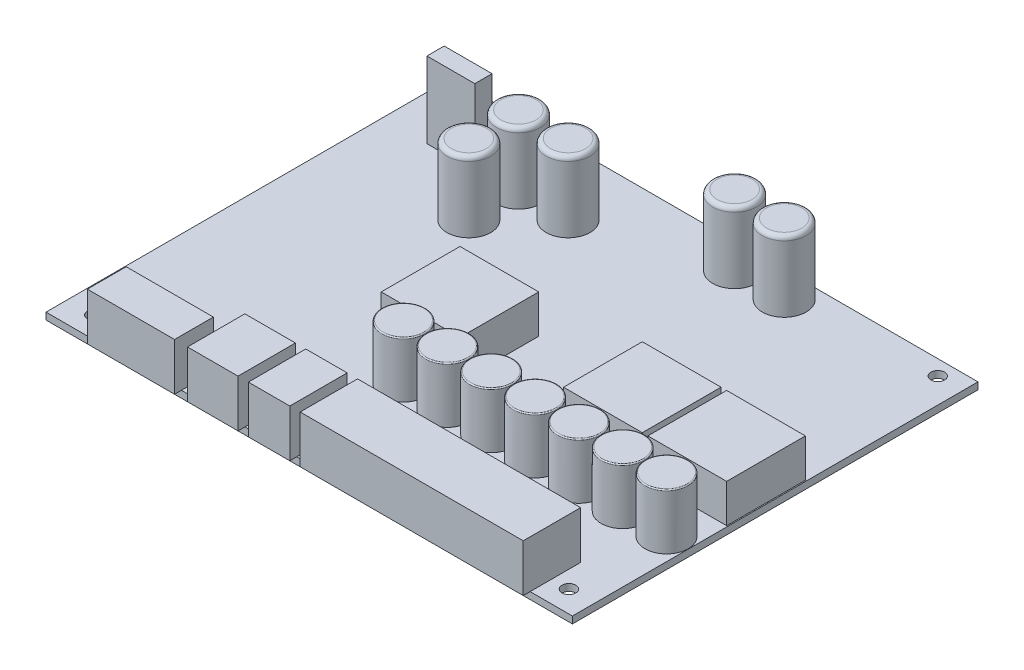
from build123d import *

# Parameters (mm, degrees)
SKETCH1_W              = 122
SKETCH1_H              = 94
BOSS_EXTRUDE1_DEPTH    = 1.6
SKETCH2_R              = 1.585
CUT_EXTRUDE1_DEPTH     = 78.023113414
SKETCH3_R              = 5.085
BOSS_EXTRUDE2_DEPTH    = 16.35
FILLET1_R              = 1.016
SKETCH4_R              = 5
BOSS_EXTRUDE3_DEPTH    = 12.9
FILLET2_R              = 0.254
LPATTERN1_COUNT        = 7
LPATTERN1_PITCH        = 10.16
FILLET2_OF_LPATTERN1_R = 0.254
SKETCH5_W              = 18.25
SKETCH5_H              = 18.25
BOSS_EXTRUDE4_DEPTH    = 8.9
SKETCH6_W              = 11.1
SKETCH6_H              = 4
BOSS_EXTRUDE5_DEPTH    = 17.6
SKETCH7_W              = 20.2
SKETCH7_H              = 9
SKETCH7_W_2            = 11.709999948
SKETCH7_H_2            = 13.3
SKETCH7_W_3            = 9.6
SKETCH7_W_4            = 51.699999978
BOSS_EXTRUDE6_DEPTH    = 11


with BuildPart() as part:
    # Sketch1 → Boss-Extrude1 (new body)
    with BuildSketch(Plane(origin=(0, 0, 0), x_dir=(1, 0, 0), z_dir=(0, 1, 0))):
        Rectangle(SKETCH1_W, SKETCH1_H)
    extrude(amount=BOSS_EXTRUDE1_DEPTH)

    # Sketch2 → Cut-Extrude1 (cut, through all)
    with BuildSketch(Plane(origin=(0, 1.6, 0), x_dir=(1, 0, 0), z_dir=(0, 1, 0))):
        with Locations(Location((-54.82, 43.5, 0), (0, 0, 270))):
            Circle(SKETCH2_R)
        with Locations(Location((55.18, 43.5, 0), (0, 0, 270))):
            Circle(SKETCH2_R)
        with Locations(Location((55.18, -42, 0), (0, 0, 270))):
            Circle(SKETCH2_R)
        with Locations(Location((-54.82, -42, 0), (0, 0, 270))):
            Circle(SKETCH2_R)
    extrude(amount=-CUT_EXTRUDE1_DEPTH, mode=Mode.SUBTRACT)

    # Sketch3 → Boss-Extrude2 (add)
    with BuildSketch(Plane(origin=(0, 1.6, 0), x_dir=(1, 0, 0), z_dir=(0, 1, 0))):
        with Locations(Location((22, 41.089465704, 0), (0, 0, 270))):
            Circle(SKETCH3_R)
        with Locations(Location((10.5, 41.089465704, 0), (0, 0, 270))):
            Circle(SKETCH3_R)
        with Locations(Location((-19, 32, 0), (0, 0, 270))):
            Circle(SKETCH3_R)
        with Locations(Location((-30.5, 32, 0), (0, 0, 270))):
            Circle(SKETCH3_R)
        with Locations(Location((-30.5, 20.5, 0), (0, 0, 270))):
            Circle(SKETCH3_R)
    extrude(amount=BOSS_EXTRUDE2_DEPTH)

    # Fillet1
    fillet1_edges = [part.edges().sort_by_distance(p)[0] for p in [
        (22, 17.95, -46.174465704),
        (10.5, 17.95, -46.174465704),
        (-19, 17.95, -37.085),
        (-30.5, 17.95, -37.085),
        (-30.5, 17.95, -25.585),
    ]]
    fillet(fillet1_edges, radius=FILLET1_R)

    # Sketch4 → Boss-Extrude3 (add)
    with BuildSketch(Plane(origin=(0, 1.6, 0), x_dir=(1, 0, 0), z_dir=(0, 1, 0))):
        with Locations(Location((55.92, -20.1, 0), (0, 0, 90))):
            Circle(SKETCH4_R)
    boss_extrude3 = extrude(amount=BOSS_EXTRUDE3_DEPTH)

    # Fillet2
    fillet2_edges = [part.edges().sort_by_distance(p)[0] for p in [
        (55.92, 14.5, 25.1),
    ]]
    fillet(fillet2_edges, radius=FILLET2_R)

    # LPattern1: Boss-Extrude3 ×7
    with Locations(*[(-i * LPATTERN1_PITCH, 0, 0) for i in range(1, LPATTERN1_COUNT)]):
        add(boss_extrude3)

    # Fillet2 of LPattern1
    fillet2_of_lpattern1_edges = [part.edges().sort_by_distance(p)[0] for p in [
        (45.76, 14.5, 25.1),
        (35.6, 14.5, 25.1),
        (25.44, 14.5, 25.1),
        (15.28, 14.5, 25.1),
        (5.12, 14.5, 25.1),
        (-5.04, 14.5, 25.1),
    ]]
    fillet(fillet2_of_lpattern1_edges, radius=FILLET2_OF_LPATTERN1_R)

    # Sketch5 → Boss-Extrude4 (add)
    with BuildSketch(Plane(origin=(0, 1.6, 0), x_dir=(1, 0, 0), z_dir=(0, 1, 0))):
        with Locations((51.621, -1.875)):
            Rectangle(SKETCH5_W, SKETCH5_H)
        with Locations((32.071, -1.875)):
            Rectangle(SKETCH5_W, SKETCH5_H)
        with Locations((-8.179, -3.875)):
            Rectangle(SKETCH5_W, SKETCH5_H)
    extrude(amount=BOSS_EXTRUDE4_DEPTH)

    # Sketch6 → Boss-Extrude5 (add)
    with BuildSketch(Plane(origin=(0, 1.6, 0), x_dir=(1, 0, 0), z_dir=(0, 1, 0))):
        with Locations((-45.115858771, 32.945131729)):
            Rectangle(SKETCH6_W, SKETCH6_H)
    extrude(amount=BOSS_EXTRUDE5_DEPTH)

    # Sketch7 → Boss-Extrude6 (add)
    with BuildSketch(Plane(origin=(0, 1.6, 0), x_dir=(1, 0, 0), z_dir=(0, 1, 0))):
        with Locations((-39.709999884, -44.1)):
            Rectangle(SKETCH7_W, SKETCH7_H)
        with Locations((-20.75499991, -41.95)):
            Rectangle(SKETCH7_W_2, SKETCH7_H_2)
        with Locations((-7.699999936, -41.95)):
            Rectangle(SKETCH7_W_3, SKETCH7_H_2)
        with Locations((25.350000053, -41.95)):
            Rectangle(SKETCH7_W_4, SKETCH7_H_2)
    extrude(amount=BOSS_EXTRUDE6_DEPTH)


solid = part.part
